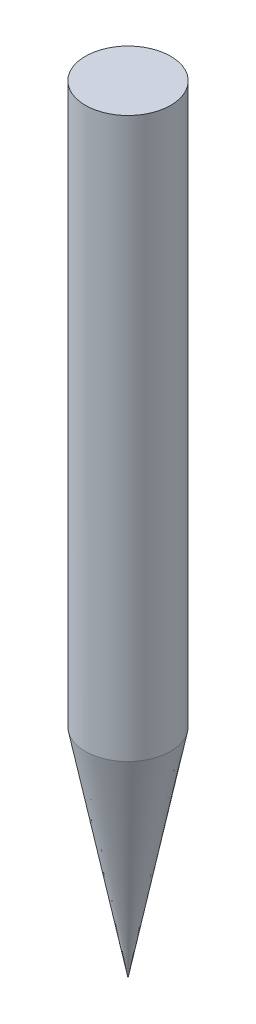
from build123d import *


with BuildPart() as part:
    # Sketch1 → Revolve1 (revolve)
    with BuildSketch(Plane.XY, mode=Mode.PRIVATE) as revolve1_sk:
        Polygon((0, 62.5), (-3.425, 62.5), (-3.425, 17.5), (0, 0), align=None)
    revolve(revolve1_sk.sketch.rotate(Axis((0, -1000, 0), (0, 1, 0)), 180), axis=Axis((0, -1000, 0), (0, 1, 0)))


solid = part.part
